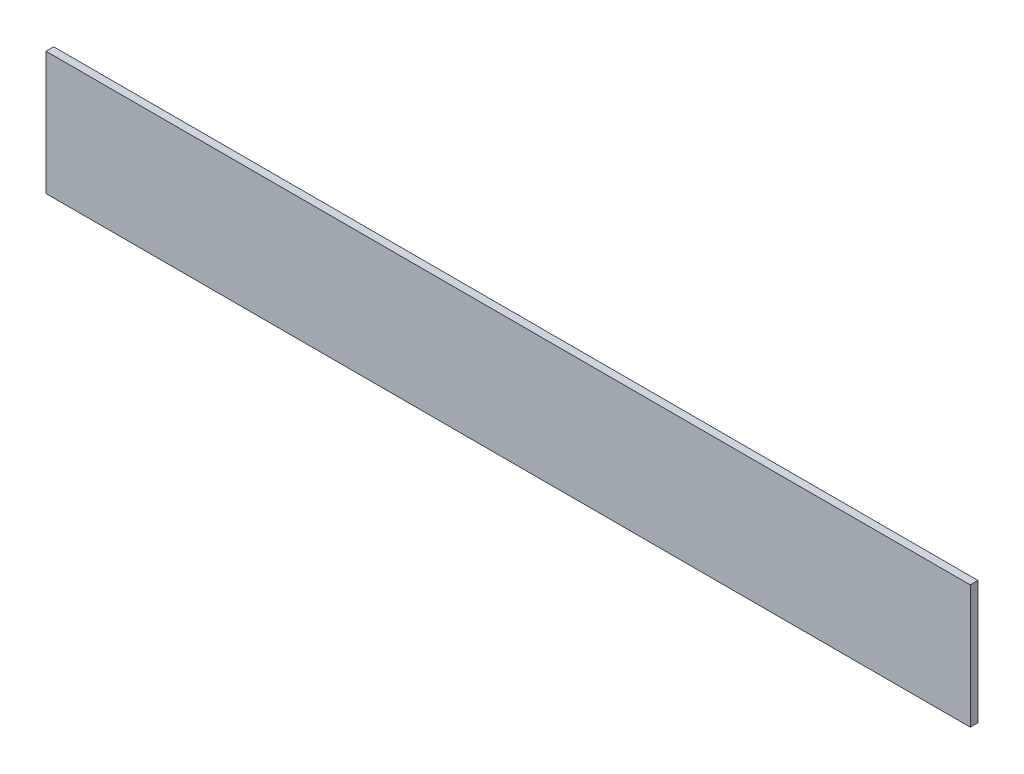
from build123d import *

# Parameters (mm, degrees)
SKETCH1_W           = 381
SKETCH1_H           = 50.8
BOSS_EXTRUDE1_DEPTH = 3.175


with BuildPart() as part:
    # Sketch1 → Boss-Extrude1 (new body)
    with BuildSketch(Plane.XY):
        with Locations((190.5, 25.4)):
            Rectangle(SKETCH1_W, SKETCH1_H)
    extrude(amount=BOSS_EXTRUDE1_DEPTH)


solid = part.part
